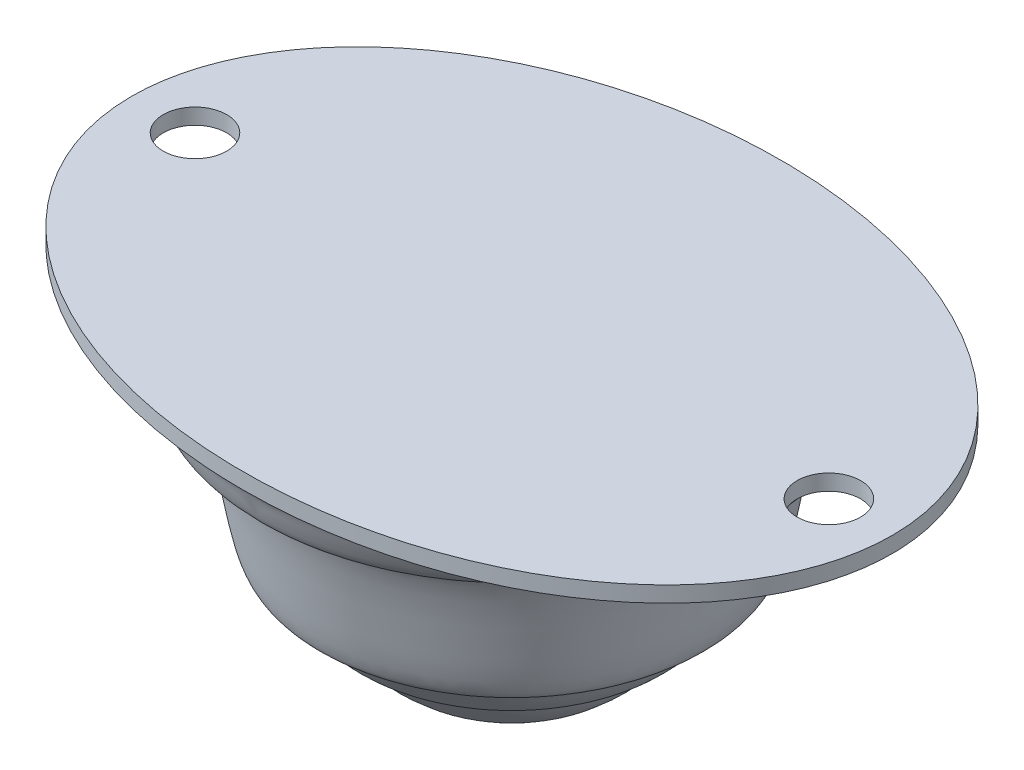
from build123d import *

# Parameters (mm, degrees)
SKETCH2_RX          = 24
SKETCH2_RY          = 17
SKETCH2_R           = 2
BOSS_EXTRUDE1_DEPTH = 1


with BuildPart() as part:
    # Sketch1 → Revolve1 (revolve)
    with BuildSketch(Plane.XY):
        with BuildLine():
            Line((17, 0), (0, 0))
            Line((0, 0), (0, -19))
            ThreePointArc((0, -19), (5.082572599, -17.626831408), (8.782128956, -13.880977837))
            add(Edge.make_bspline(
                [(17, 0), (16.498849833, -0.232288976), (16.221438117, -3.076965946), (13.317896084, -2.27360381), (12.765724667, -12.145956319), (11.365086728, -11.243918489), (10.422368884, -12.692973846), (8.549719544, -15.110973084), (9.243837127, -11.326594194), (8.782128956, -13.880977837)],
                knots=[0, 0, 0, 0, 0.235120253, 0.368864113, 0.707611151, 0.794740735, 0.87385528, 0.920941597, 1, 1, 1, 1], degree=3))
        make_face()
    revolve(axis=Axis((0, 0, 0), (0, -1, 0)))

    # Sketch2 → Boss-Extrude1 (add)
    with BuildSketch(Plane(origin=(0, 0, 0), x_dir=(1, 0, 0), z_dir=(0, 1, 0))):
        with Locations(Location((0, 0), (0, 0, 0))):
            Ellipse(SKETCH2_RX, SKETCH2_RY)
        with Locations(Location((-20, 0, 0), (0, 0, 180))):
            Circle(SKETCH2_R, mode=Mode.SUBTRACT)
        with Locations(Location((20, 0, 0), (0, 0, 180))):
            Circle(SKETCH2_R, mode=Mode.SUBTRACT)
    extrude(amount=BOSS_EXTRUDE1_DEPTH)


solid = part.part
